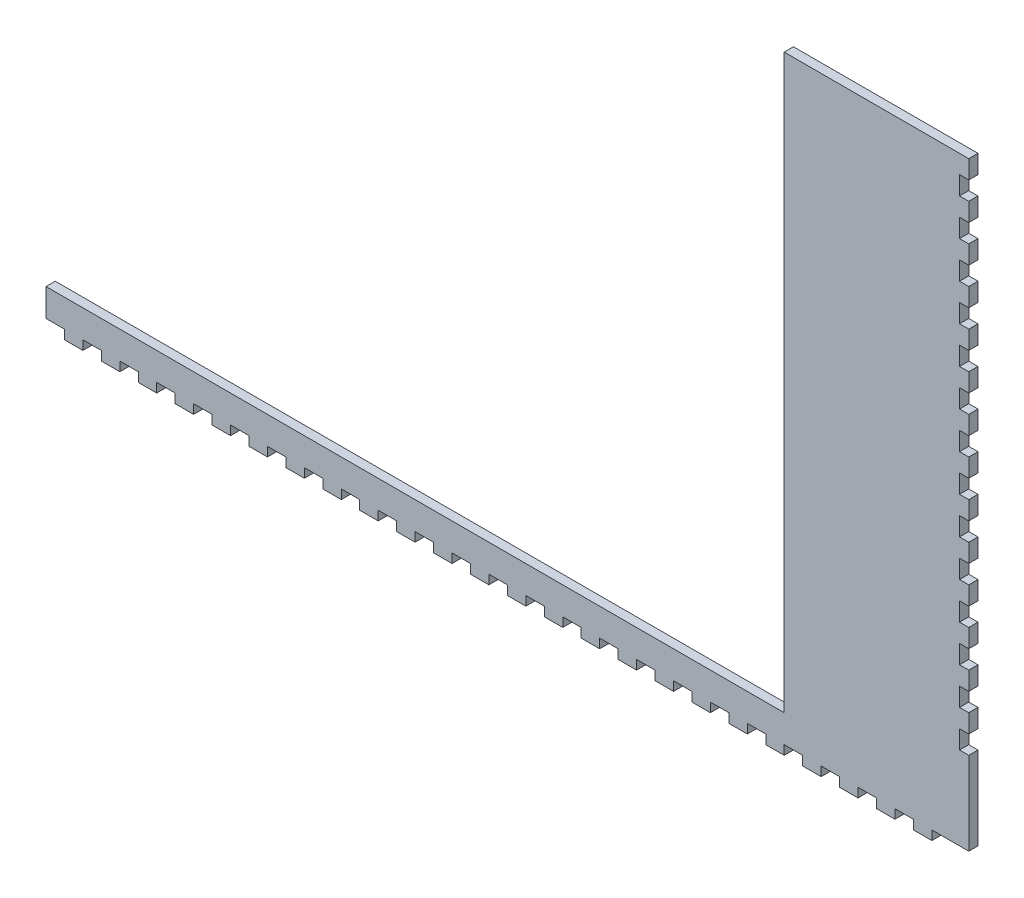
from build123d import *

# Parameters (mm, degrees)
BOSS_EXTRU_1_DEPTH      = 5
ESQUISSE2_W             = 10
ESQUISSE2_H             = 5
ESQUISSE2_W_2           = 5
ESQUISSE2_H_2           = 10
ENL_V_MAT_EXTRU_2_DEPTH = 600.103496902


with BuildPart() as part:
    # Esquisse1 → Boss.-Extru.1 (new body)
    with BuildSketch(Plane.XY):
        Polygon((400, 20), (400, 330), (500, 330), (500, 0), (400, 0), (0, 0), (0, 20), align=None)
    extrude(amount=BOSS_EXTRU_1_DEPTH)

    # Esquisse2 → Enlèv. mat.-Extru.2 (cut, through all)
    with BuildSketch(Plane.XY.offset(5)):
        with Locations((25, 2.5)):
            Rectangle(ESQUISSE2_W, ESQUISSE2_H)
        with Locations((5, 2.5)):
            Rectangle(ESQUISSE2_W, ESQUISSE2_H)
        with Locations((45, 2.5)):
            Rectangle(ESQUISSE2_W, ESQUISSE2_H)
        with Locations((65, 2.5)):
            Rectangle(ESQUISSE2_W, ESQUISSE2_H)
        with Locations((85, 2.5)):
            Rectangle(ESQUISSE2_W, ESQUISSE2_H)
        with Locations((105, 2.5)):
            Rectangle(ESQUISSE2_W, ESQUISSE2_H)
        with Locations((125, 2.5)):
            Rectangle(ESQUISSE2_W, ESQUISSE2_H)
        with Locations((145, 2.5)):
            Rectangle(ESQUISSE2_W, ESQUISSE2_H)
        with Locations((165, 2.5)):
            Rectangle(ESQUISSE2_W, ESQUISSE2_H)
        with Locations((185, 2.5)):
            Rectangle(ESQUISSE2_W, ESQUISSE2_H)
        with Locations((205, 2.5)):
            Rectangle(ESQUISSE2_W, ESQUISSE2_H)
        with Locations((225, 2.5)):
            Rectangle(ESQUISSE2_W, ESQUISSE2_H)
        with Locations((245, 2.5)):
            Rectangle(ESQUISSE2_W, ESQUISSE2_H)
        with Locations((265, 2.5)):
            Rectangle(ESQUISSE2_W, ESQUISSE2_H)
        with Locations((285, 2.5)):
            Rectangle(ESQUISSE2_W, ESQUISSE2_H)
        with Locations((305, 2.5)):
            Rectangle(ESQUISSE2_W, ESQUISSE2_H)
        with Locations((325, 2.5)):
            Rectangle(ESQUISSE2_W, ESQUISSE2_H)
        with Locations((345, 2.5)):
            Rectangle(ESQUISSE2_W, ESQUISSE2_H)
        with Locations((365, 2.5)):
            Rectangle(ESQUISSE2_W, ESQUISSE2_H)
        with Locations((385, 2.5)):
            Rectangle(ESQUISSE2_W, ESQUISSE2_H)
        with Locations((405, 2.5)):
            Rectangle(ESQUISSE2_W, ESQUISSE2_H)
        with Locations((425, 2.5)):
            Rectangle(ESQUISSE2_W, ESQUISSE2_H)
        with Locations((445, 2.5)):
            Rectangle(ESQUISSE2_W, ESQUISSE2_H)
        with Locations((465, 2.5)):
            Rectangle(ESQUISSE2_W, ESQUISSE2_H)
        Polygon((480, 0), (480, 5), (490, 5), (500, 5), (500, 0), (490, 0), align=None)
        with Locations((497.5, 315)):
            Rectangle(ESQUISSE2_W_2, ESQUISSE2_H_2)
        with Locations((497.5, 295)):
            Rectangle(ESQUISSE2_W_2, ESQUISSE2_H_2)
        with Locations((497.5, 275)):
            Rectangle(ESQUISSE2_W_2, ESQUISSE2_H_2)
        with Locations((497.5, 255)):
            Rectangle(ESQUISSE2_W_2, ESQUISSE2_H_2)
        with Locations((497.5, 235)):
            Rectangle(ESQUISSE2_W_2, ESQUISSE2_H_2)
        with Locations((497.5, 215)):
            Rectangle(ESQUISSE2_W_2, ESQUISSE2_H_2)
        with Locations((497.5, 195)):
            Rectangle(ESQUISSE2_W_2, ESQUISSE2_H_2)
        with Locations((497.5, 175)):
            Rectangle(ESQUISSE2_W_2, ESQUISSE2_H_2)
        with Locations((497.5, 155)):
            Rectangle(ESQUISSE2_W_2, ESQUISSE2_H_2)
        with Locations((497.5, 135)):
            Rectangle(ESQUISSE2_W_2, ESQUISSE2_H_2)
        with Locations((497.5, 115)):
            Rectangle(ESQUISSE2_W_2, ESQUISSE2_H_2)
        with Locations((497.5, 95)):
            Rectangle(ESQUISSE2_W_2, ESQUISSE2_H_2)
        with Locations((497.5, 75)):
            Rectangle(ESQUISSE2_W_2, ESQUISSE2_H_2)
        with Locations((497.5, 55)):
            Rectangle(ESQUISSE2_W_2, ESQUISSE2_H_2)
    extrude(amount=-ENL_V_MAT_EXTRU_2_DEPTH, mode=Mode.SUBTRACT)


solid = part.part
